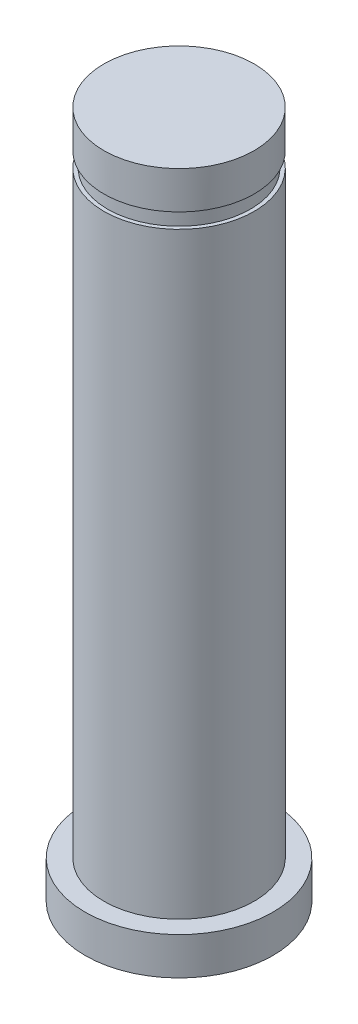
from build123d import *

# Parameters (mm, degrees)
SKETCH_1_R      = 5
EXTRUDE_1_DEPTH = 2
SKETCH_2_R      = 4
EXTRUDE_2_DEPTH = 34.6
SKETCH_3_W      = 0.4
SKETCH_3_H      = 0.8


with BuildPart() as part:
    # 草图1 → 凸台-拉伸1 (new body)
    with BuildSketch(Plane(origin=(0, 0, 0), x_dir=(1, 0, 0), z_dir=(0, 1, 0))):
        with Locations(Location((0, 0, 0), (0, 0, 270))):
            Circle(SKETCH_1_R)
    extrude(amount=EXTRUDE_1_DEPTH)

    # 草图2 → 凸台-拉伸2 (add)
    with BuildSketch(Plane(origin=(0, 2, 0), x_dir=(1, 0, 0), z_dir=(0, 1, 0))):
        with Locations(Location((0, 0, 0), (0, 0, 270))):
            Circle(SKETCH_2_R)
    extrude(amount=EXTRUDE_2_DEPTH)

    # 草图3 → 切除-旋转1 (revolve, cut)
    with BuildSketch(Plane.XY, mode=Mode.PRIVATE) as cut_revolve_1_sk:
        with Locations((4, 34.2)):
            Rectangle(SKETCH_3_W, SKETCH_3_H)
    revolve(cut_revolve_1_sk.sketch.rotate(Axis((0, 36.6, 0), (0, -1, 0)), 90), axis=Axis((0, 36.6, 0), (0, -1, 0)), mode=Mode.SUBTRACT)


solid = part.part
